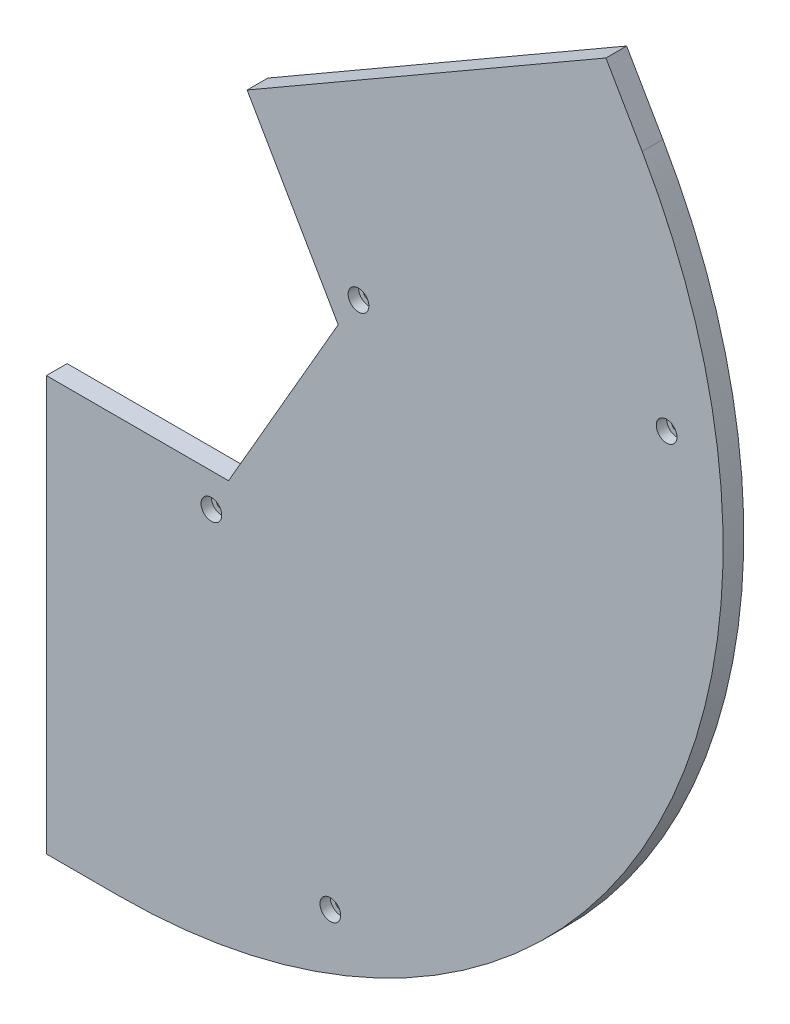
from build123d import *

# Parameters (mm, degrees)
EXTRUDE_1_DEPTH     = 6
CUT_EXTRUDE_1_DEPTH = 248.560093715
SKETCH_3_W          = 6
SKETCH_3_H          = 120
EXTRUDE_2_DEPTH     = 21
SKETCH_4_W          = 120
SKETCH_4_H          = 6
EXTRUDE_3_DEPTH     = 21
SKETCH_5_R          = 1.6
CUT_EXTRUDE_2_DEPTH = 248.560093715
SKETCH_6_R          = 3
CUT_EXTRUDE_3_DEPTH = 3


with BuildPart() as part:
    # 草圖1 → 填料-伸長1 (new body)
    with BuildSketch(Plane.XY):
        with BuildLine():
            Line((0, 0), (0, -175))
            ThreePointArc((0, -175), (151.554445662, -87.5), (151.554445662, 87.5))
            Line((151.554445662, 87.5), (0, 0))
        make_face()
    extrude(amount=EXTRUDE_1_DEPTH)

    # 草圖2 → 除料-伸長1 (cut, through all)
    with BuildSketch(Plane.XY.offset(6)):
        with BuildLine():
            Line((0, 0), (0, -55))
            ThreePointArc((0, -55), (27.500000113, -47.631397143), (47.631397339, -27.499999773))
            ThreePointArc((47.631397339, -27.499999773), (53.12592048, -14.235047354), (55, 0))
            ThreePointArc((55, 0), (53.125920434, 14.235047524), (47.631397163, 27.500000078))
            Line((47.631397208, 27.5), (0, 0))
        make_face()
        with BuildLine():
            ThreePointArc((0, 55), (-55, 0), (0, -55))
            Line((0, -55), (0, 0))
            Line((0, 0), (47.631397208, 27.5))
            ThreePointArc((47.631397163, 27.500000078), (27.499999961, 47.631397231), (0, 55))
        make_face()
        with BuildLine():
            ThreePointArc((47.631397339, -27.499999773), (27.500000113, -47.631397143), (0, -55))
            Line((0, -55), (31.754264805, -55))
            Line((31.754264805, -55), (47.631397339, -27.499999773))
        make_face()
        with BuildLine():
            ThreePointArc((55, 0), (53.12592048, -14.235047354), (47.631397339, -27.499999773))
            Line((47.631397339, -27.499999773), (63.508529611, 0))
            Line((63.508529611, 0), (47.631397163, 27.500000078))
            ThreePointArc((47.631397163, 27.500000078), (53.125920434, 14.235047524), (55, 0))
        make_face()
    extrude(amount=-CUT_EXTRUDE_1_DEPTH, mode=Mode.SUBTRACT)

    # 草圖3 → 填料-伸長2 (add)
    with BuildSketch(Plane.ZY):
        with Locations((3, -115)):
            Rectangle(SKETCH_3_W, SKETCH_3_H)
    extrude(amount=EXTRUDE_2_DEPTH)

    # 草圖4 → 填料-伸長3 (add)
    with BuildSketch(Plane(origin=(0, 0, 0), x_dir=(0.8660254037844362, 0.5000000000000046, 0), z_dir=(-0.5000000000000044, 0.866025403784436, 0))):
        with Locations((115, -3)):
            Rectangle(SKETCH_4_W, SKETCH_4_H)
    extrude(amount=EXTRUDE_3_DEPTH)

    # 草圖5 → 除料-伸長2 (cut, through all)
    with BuildSketch(Plane.XY.offset(6)):
        with Locations((61.229349178, -147.820725202)):
            Circle(SKETCH_5_R)
        with Locations((26.787840266, -64.671567276)):
            Circle(SKETCH_5_R)
        with Locations(Location((158.63117782, 20.884190755, 0), (0, 0, 180))):
            Circle(SKETCH_5_R)
        with Locations(Location((69.401140296, 9.136833455, 0), (0, 0, 180))):
            Circle(SKETCH_5_R)
    extrude(amount=-CUT_EXTRUDE_2_DEPTH, mode=Mode.SUBTRACT)

    # 草圖6 → 除料-伸長3 (cut)
    with BuildSketch(Plane.XY.offset(6)):
        with Locations((61.229349178, -147.820725202)):
            Circle(SKETCH_6_R)
        with Locations((26.787840266, -64.671567276)):
            Circle(SKETCH_6_R)
        with Locations((69.401140296, 9.136833455)):
            Circle(SKETCH_6_R)
        with Locations((158.63117782, 20.884190755)):
            Circle(SKETCH_6_R)
    extrude(amount=-CUT_EXTRUDE_3_DEPTH, mode=Mode.SUBTRACT)


solid = part.part
